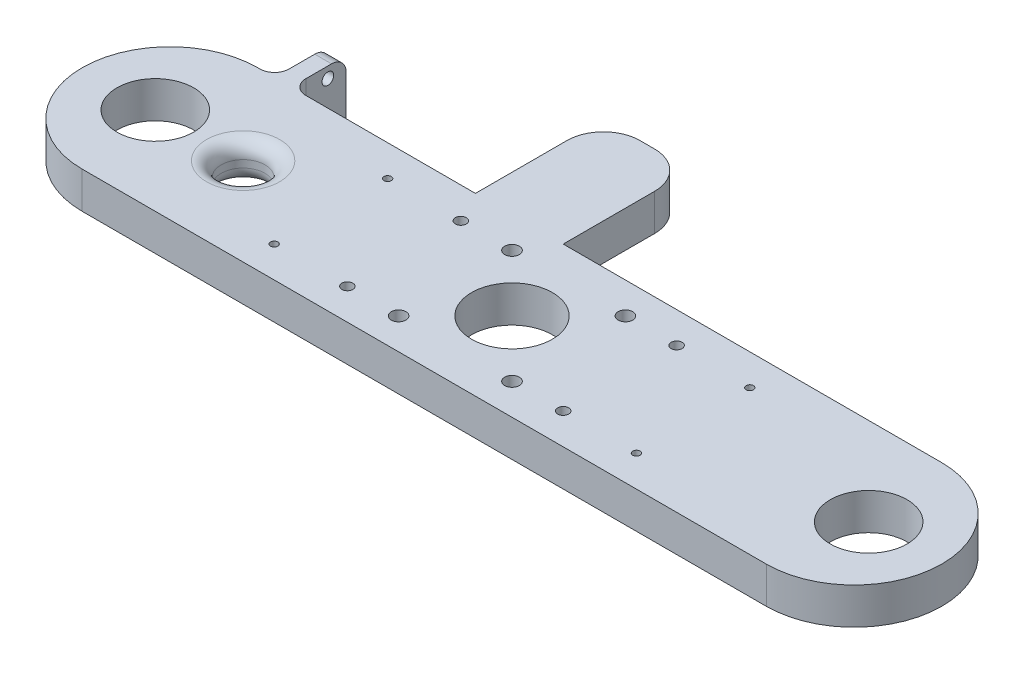
from build123d import *

# Parameters (mm, degrees)
BOSS_EXTRUDE1_DEPTH = 10
SKETCH2_R           = 10.5
SKETCH2_R_2         = 6
SKETCH2_R_3         = 11.05
SKETCH2_R_4         = 2
SKETCH2_R_5         = 1.5
SKETCH2_R_6         = 1
CUT_EXTRUDE1_DEPTH  = 10
FILLET1_R           = 4
FILLET2_R           = 4
SKETCH3_W           = 4.58
SKETCH3_H           = 20
BOSS_EXTRUDE2_DEPTH = 15
FILLET3_R           = 4
FILLET4_R           = 4
FILLET5_R           = 4
SKETCH4_R           = 1.6
CUT_EXTRUDE2_DEPTH  = 15


with BuildPart() as part:
    # Sketch1 → Boss-Extrude1 (new body)
    with BuildSketch(Plane(origin=(0, 0, 0), x_dir=(1, 0, 0), z_dir=(0, 1, 0))):
        with BuildLine():
            Line((-34, 49), (-34, 24))
            Line((-34, 24), (-10, 24))
            Line((-10, 24), (-10, 49))
            ThreePointArc((-10, 49), (-12.928932188, 56.071067812), (-20, 59))
            Line((-20, 59), (-24, 59))
            ThreePointArc((-24, 59), (-31.071067812, 56.071067812), (-34, 49))
        make_face()
        with BuildLine():
            Line((-93.5, -24), (93.5, -24))
            ThreePointArc((93.5, -24), (117.5, 0), (93.5, 24))
            Line((93.5, 24), (-93.5, 24))
            ThreePointArc((-93.5, 24), (-117.5, 0), (-93.5, -24))
        make_face()
    extrude(amount=BOSS_EXTRUDE1_DEPTH)

    # Sketch2 → Cut-Extrude1 (cut)
    with BuildSketch(Plane(origin=(0, 10, 0), x_dir=(1, 0, 0), z_dir=(0, 1, 0))):
        with Locations(Location((-97.5, 0, 0), (0, 0, 270))):
            Circle(SKETCH2_R)
        with Locations(Location((97.5, 0, 0), (0, 0, 270))):
            Circle(SKETCH2_R)
        with Locations(Location((-73.5, 0, 0), (0, 0, 270))):
            Circle(SKETCH2_R_2)
        with Locations(Location((0, 0, 0), (0, 0, 270))):
            Circle(SKETCH2_R_3)
        with Locations(Location((-15.5, 15.5, 0), (0, 0, 270))):
            Circle(SKETCH2_R_4)
        with Locations(Location((15.5, 15.5, 0), (0, 0, 270))):
            Circle(SKETCH2_R_4)
        with Locations(Location((-15.5, -15.5, 0), (0, 0, 270))):
            Circle(SKETCH2_R_4)
        with Locations(Location((15.5, -15.5, 0), (0, 0, 270))):
            Circle(SKETCH2_R_4)
        with Locations(Location((29.5, 15.5, 0), (0, 0, 270))):
            Circle(SKETCH2_R_5)
        with Locations(Location((29.5, -15.5, 0), (0, 0, 270))):
            Circle(SKETCH2_R_5)
        with Locations(Location((-29.5, 15.5, 0), (0, 0, 270))):
            Circle(SKETCH2_R_5)
        with Locations(Location((-29.5, -15.5, 0), (0, 0, 270))):
            Circle(SKETCH2_R_5)
        with Locations(Location((-49.5, 15.5, 0), (0, 0, 270))):
            Circle(SKETCH2_R_6)
        with Locations(Location((-49.5, -15.5, 0), (0, 0, 270))):
            Circle(SKETCH2_R_6)
        with Locations(Location((49.5, 15.5, 0), (0, 0, 270))):
            Circle(SKETCH2_R_6)
        with Locations(Location((49.5, -15.5, 0), (0, 0, 270))):
            Circle(SKETCH2_R_6)
    extrude(amount=-CUT_EXTRUDE1_DEPTH, mode=Mode.SUBTRACT)

    # Fillet1
    fillet1_edges = [part.edges().sort_by_distance(p)[0] for p in [
        (-73.5, 10, -6),
    ]]
    fillet(fillet1_edges, radius=FILLET1_R)

    # Fillet2
    fillet2_edges = [part.edges().sort_by_distance(p)[0] for p in [
        (-73.5, 0, -6),
    ]]
    fillet(fillet2_edges, radius=FILLET2_R)

    # Sketch3 → Boss-Extrude2 (add)
    with BuildSketch(Plane(origin=(0, 0, -24), x_dir=(-1, 0, 0), z_dir=(0, 0, -1))):
        with Locations((86.62, 0)):
            Rectangle(SKETCH3_W, SKETCH3_H)
    extrude(amount=BOSS_EXTRUDE2_DEPTH)

    # Fillet3
    fillet3_edges = [part.edges().sort_by_distance(p)[0] for p in [
        (-86.62, 0, -24),
    ]]
    fillet(fillet3_edges, radius=FILLET3_R)

    # Fillet4
    fillet4_edges = [part.edges().sort_by_distance(p)[0] for p in [
        (-84.33, 5, -24),
        (-88.91, 5, -24),
    ]]
    fillet(fillet4_edges, radius=FILLET4_R)

    # Fillet5
    fillet5_edges = [part.edges().sort_by_distance(p)[0] for p in [
        (-86.62, -10, -24),
        (-86.62, -10, -39),
        (-86.62, 10, -39),
    ]]
    fillet(fillet5_edges, radius=FILLET5_R)

    # Sketch4 → Cut-Extrude2 (cut)
    with BuildSketch(Plane.ZY.offset(88.91)):
        with Locations((-34, 7)):
            Circle(SKETCH4_R)
        with Locations((-34, -7)):
            Circle(SKETCH4_R)
    extrude(amount=-CUT_EXTRUDE2_DEPTH, mode=Mode.SUBTRACT)


solid = part.part
